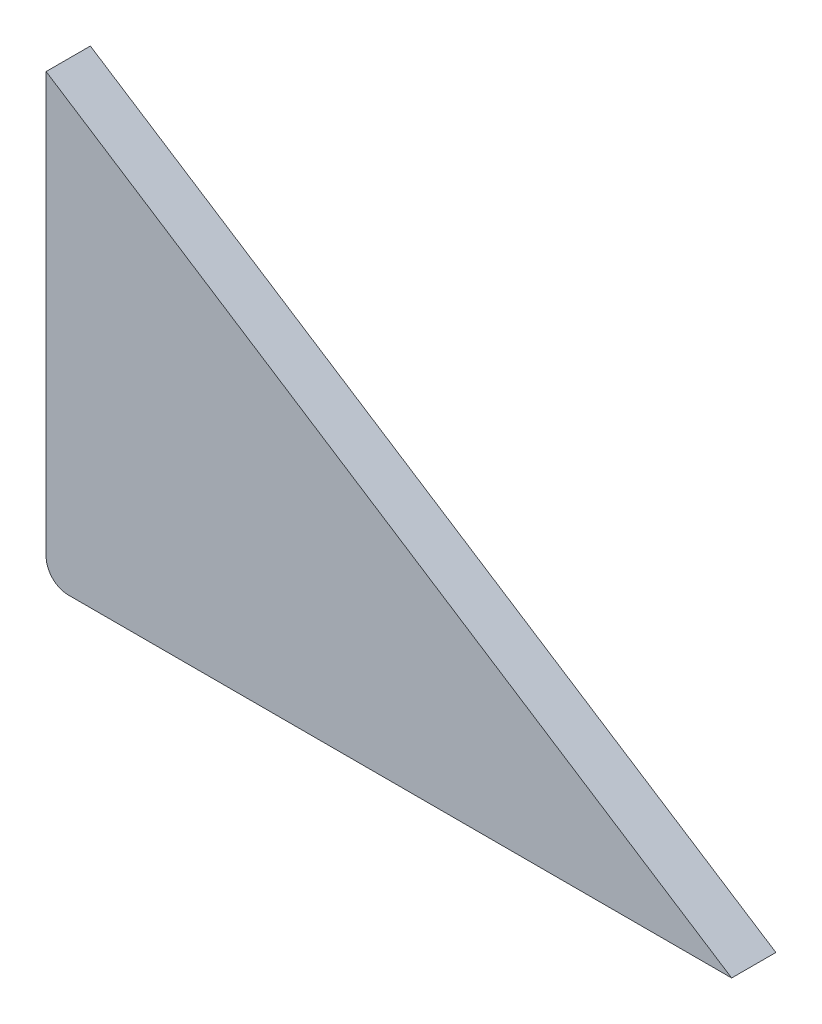
from build123d import *

# Parameters (mm, degrees)
BOSS_EXTRUDE1_DEPTH = 6.35
FILLET1_R           = 3.175


with BuildPart() as part:
    # Sketch2 → Boss-Extrude1 (new body)
    with BuildSketch(Plane.XY):
        Polygon((0, 0), (98.425, 0), (0, 63.5), align=None)
    extrude(amount=BOSS_EXTRUDE1_DEPTH)

    # Fillet1
    fillet1_edges = [part.edges().sort_by_distance(p)[0] for p in [
        (0, 0, 3.175),
    ]]
    fillet(fillet1_edges, radius=FILLET1_R)


solid = part.part
